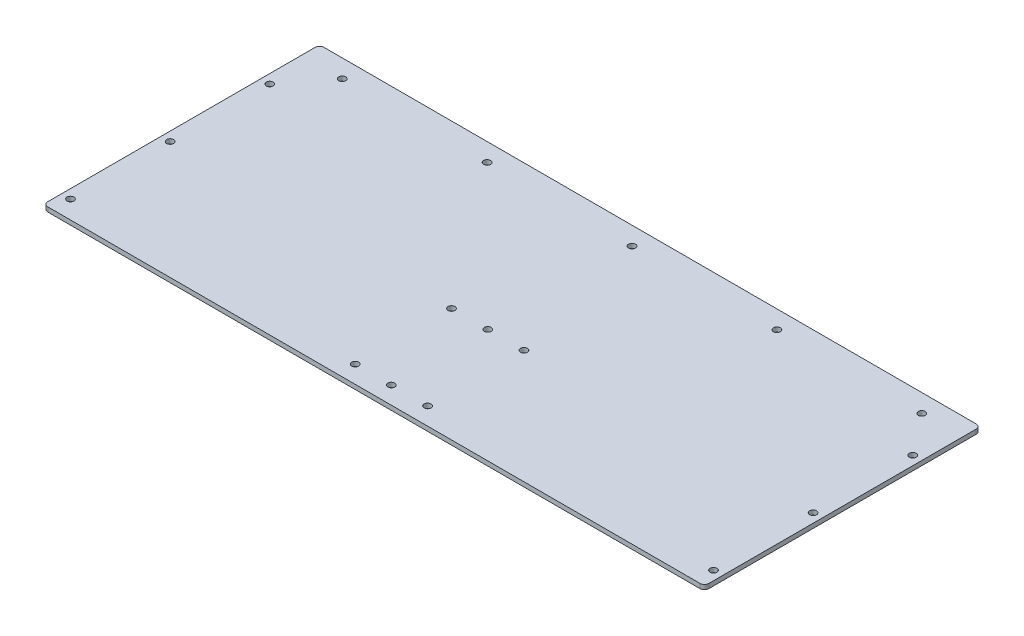
from build123d import *

# Parameters (mm, degrees)
SKETCH1_W           = 463.55
SKETCH1_H           = 193.675
SKETCH1_R           = 2.4257
BOSS_EXTRUDE1_DEPTH = 3.175
SKETCH2_R           = 2.4257
CUT_EXTRUDE1_DEPTH  = 503.392962481
FILLET1_R           = 3.175


with BuildPart() as part:
    # Sketch1 → Boss-Extrude1 (new body)
    with BuildSketch(Plane(origin=(0, 0, 0), x_dir=(1, 0, 0), z_dir=(0, 1, 0))):
        with Locations((231.775, 96.8375)):
            Rectangle(SKETCH1_W, SKETCH1_H)
        with Locations(Location((231.775, 12.2555, 0), (0, 0, 270))):
            Circle(SKETCH1_R, mode=Mode.SUBTRACT)
        with Locations(Location((257.175, 12.2555, 0), (0, 0, 270))):
            Circle(SKETCH1_R, mode=Mode.SUBTRACT)
        with Locations(Location((206.375, 12.2555, 0), (0, 0, 90))):
            Circle(SKETCH1_R, mode=Mode.SUBTRACT)
        with Locations(Location((257.175, 79.8195, 0), (0, 0, 90))):
            Circle(SKETCH1_R, mode=Mode.SUBTRACT)
        with Locations(Location((231.775, 79.8195, 0), (0, 0, 90))):
            Circle(SKETCH1_R, mode=Mode.SUBTRACT)
        with Locations(Location((206.375, 79.8195, 0), (0, 0, 270))):
            Circle(SKETCH1_R, mode=Mode.SUBTRACT)
        with Locations(Location((231.775, 180.975, 0), (0, 0, 270))):
            Circle(SKETCH1_R, mode=Mode.SUBTRACT)
        with Locations(Location((333.375, 180.975, 0), (0, 0, 270))):
            Circle(SKETCH1_R, mode=Mode.SUBTRACT)
        with Locations(Location((434.975, 180.975, 0), (0, 0, 270))):
            Circle(SKETCH1_R, mode=Mode.SUBTRACT)
        with Locations(Location((28.575, 180.975, 0), (0, 0, 90))):
            Circle(SKETCH1_R, mode=Mode.SUBTRACT)
        with Locations(Location((130.175, 180.975, 0), (0, 0, 90))):
            Circle(SKETCH1_R, mode=Mode.SUBTRACT)
    extrude(amount=BOSS_EXTRUDE1_DEPTH)

    # Sketch2 → Cut-Extrude1 (cut, through all)
    with BuildSketch(Plane(origin=(0, 3.175, 0), x_dir=(1, 0, 0), z_dir=(0, 1, 0))):
        with Locations(Location((6.35, 12.7, 0), (0, 0, 270))):
            Circle(SKETCH2_R)
        with Locations(Location((6.35, 82.55, 0), (0, 0, 270))):
            Circle(SKETCH2_R)
        with Locations(Location((6.35, 152.4, 0), (0, 0, 270))):
            Circle(SKETCH2_R)
        with Locations((6.35, 222.25)):
            Circle(SKETCH2_R)
        with Locations((457.2, 222.25)):
            Circle(SKETCH2_R)
        with Locations(Location((457.2, 152.4, 0), (0, 0, 90))):
            Circle(SKETCH2_R)
        with Locations(Location((457.2, 82.55, 0), (0, 0, 90))):
            Circle(SKETCH2_R)
        with Locations(Location((457.2, 12.7, 0), (0, 0, 90))):
            Circle(SKETCH2_R)
    extrude(amount=-CUT_EXTRUDE1_DEPTH, mode=Mode.SUBTRACT)

    # Fillet1
    fillet1_edges = [part.edges().sort_by_distance(p)[0] for p in [
        (0, 1.5875, -193.675),
        (463.55, 1.5875, -193.675),
        (463.55, 1.5875, 0),
        (0, 1.5875, 0),
    ]]
    fillet(fillet1_edges, radius=FILLET1_R)


solid = part.part
